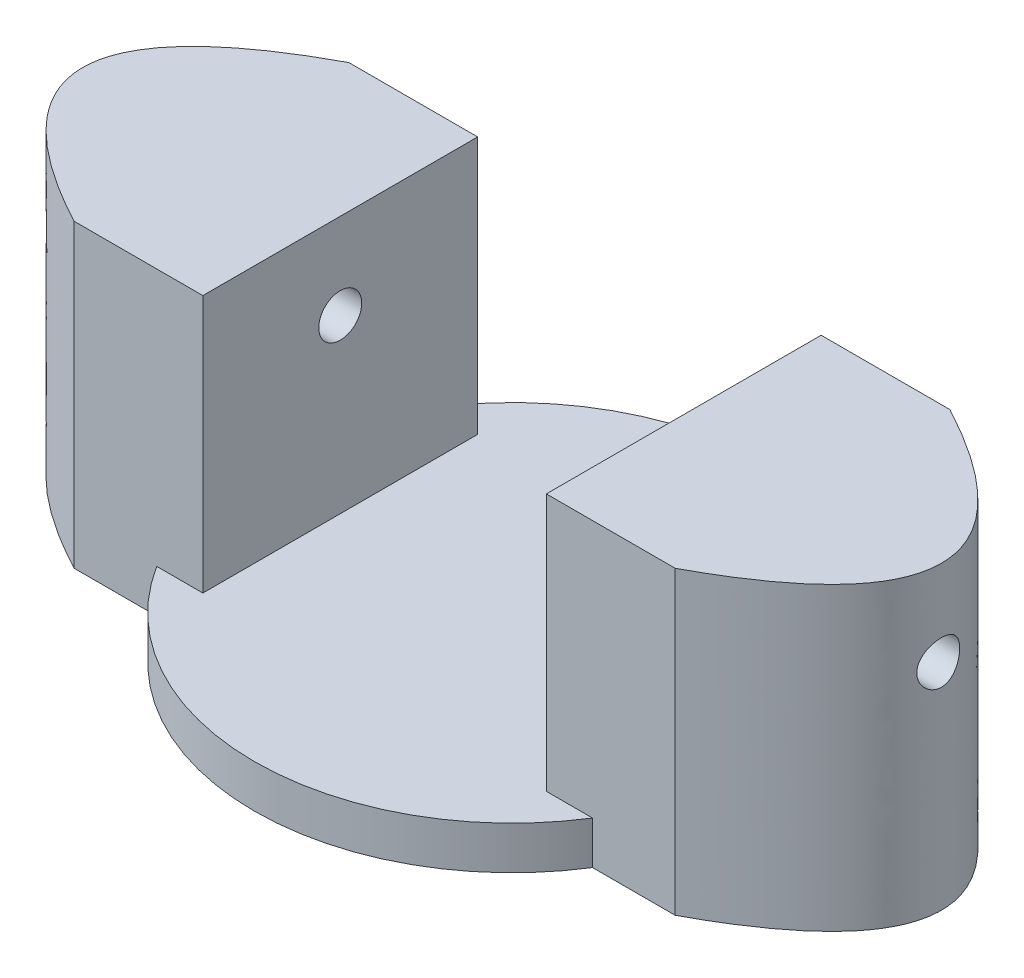
from build123d import *

# Parameters (mm, degrees)
SKETCH1_R                       = 25
BOSS_EXTRUDE1_DEPTH             = 25
SKETCH2_R                       = 150
BOSS_EXTRUDE2_DEPTH             = 25
SKETCH3_W                       = 150
SKETCH3_H                       = 160
BOSS_EXTRUDE3_DEPTH             = 150
BOSS_EXTRUDE3_DIRECTION_2_REACH = 219.945
CUT_EXTRUDE2_DEPTH              = 420.076365356
CUT_EXTRUDE2_DEPTH_BACK         = 420.076365356
SKETCH6_R                       = 12.5
CUT_EXTRUDE3_DEPTH              = 354.553390593
BOSS_EXTRUDE5_DEPTH             = 10
BOSS_EXTRUDE5_DEPTH_BACK        = 10
SKETCH9_R                       = 5


with BuildPart() as part:
    # Sketch1 → Boss-Extrude1 (new body)
    with BuildSketch(Plane(origin=(0, 0, 0), x_dir=(1, 0, 0), z_dir=(0, 1, 0))):
        with Locations(Location((0, 0, 0), (0, 0, 270))):
            Circle(SKETCH1_R)
    extrude(amount=-BOSS_EXTRUDE1_DEPTH)

    # Sketch2 → Boss-Extrude2 (add)
    with BuildSketch(Plane(origin=(0, 0, 0), x_dir=(1, 0, 0), z_dir=(0, 1, 0))):
        with Locations(Location((0, 0, 0), (0, 0, 270))):
            Circle(SKETCH2_R)
    extrude(amount=BOSS_EXTRUDE2_DEPTH)

    # Sketch3 → Boss-Extrude3 (add)
    with BuildSketch(Plane(origin=(0, 25, 0), x_dir=(1, 0, 0), z_dir=(0, 1, 0))):
        with Locations((175, 0)):
            Rectangle(SKETCH3_W, SKETCH3_H)
        with Locations((-175, 0)):
            Rectangle(SKETCH3_W, SKETCH3_H)
    extrude(amount=BOSS_EXTRUDE3_DEPTH)

    # Boss-Extrude3 direction 2: up to this face of the body (flat: up to its plane)
    boss_extrude3_direction_2_end = Plane(part.part.faces().sort_by_distance((0, 0, -145.757359313))[0])
    # Sketch3 → Boss-Extrude3 direction 2 (add, up to the picked face)
    with BuildSketch(Plane(origin=(0, 25, 0), x_dir=(1, 0, 0), z_dir=(0, 1, 0)), mode=Mode.PRIVATE) as boss_extrude3_direction_2_sk1:
        with Locations((175, 0)):
            Rectangle(SKETCH3_W, SKETCH3_H)
    boss_extrude3_direction_2_tool1 = split(extrude(boss_extrude3_direction_2_sk1.sketch, amount=-BOSS_EXTRUDE3_DIRECTION_2_REACH, mode=Mode.PRIVATE), bisect_by=boss_extrude3_direction_2_end, keep=Keep.BOTH, mode=Mode.PRIVATE)
    # Sketch3 → Boss-Extrude3 direction 2 (add, up to the picked face)
    with BuildSketch(Plane(origin=(0, 25, 0), x_dir=(1, 0, 0), z_dir=(0, 1, 0)), mode=Mode.PRIVATE) as boss_extrude3_direction_2_sk2:
        with Locations((-175, 0)):
            Rectangle(SKETCH3_W, SKETCH3_H)
    boss_extrude3_direction_2_tool2 = split(extrude(boss_extrude3_direction_2_sk2.sketch, amount=-BOSS_EXTRUDE3_DIRECTION_2_REACH, mode=Mode.PRIVATE), bisect_by=boss_extrude3_direction_2_end, keep=Keep.BOTH, mode=Mode.PRIVATE)
    add(boss_extrude3_direction_2_tool1.solids().sort_by(Axis((175, 25, 0), (0, -1, 0)))[0])
    add(boss_extrude3_direction_2_tool2.solids().sort_by(Axis((-175, 25, 0), (0, -1, 0)))[0])

    # Sketch6 → Cut-Extrude2 (cut, two sides: drawn at the far end of the back side and taken through both)
    with BuildSketch(Plane(origin=(-100, 0, 0), x_dir=(0, 0, -1), z_dir=(1, 0, 0)).offset(-CUT_EXTRUDE2_DEPTH_BACK)):
        with Locations((0, 125)):
            Circle(SKETCH6_R)
    extrude(amount=CUT_EXTRUDE2_DEPTH + CUT_EXTRUDE2_DEPTH_BACK, mode=Mode.SUBTRACT)

    # Sketch7 → Cut-Extrude3 (cut, through all)
    with BuildSketch(Plane(origin=(0, 175, 0), x_dir=(1, 0, 0), z_dir=(0, 1, 0))):
        with BuildLine():
            Line((-250, -80), (-175, -80))
            add(Edge.make_bspline(
                [(-250, 0), (-250, -40), (-175, -80)],
                knots=[0.5, 0.5, 0.5, 1, 1, 1], degree=2))
            Line((-250, 0), (-250, -80))
        make_face()
        with BuildLine():
            Line((-250, 80), (-250, 0))
            add(Edge.make_bspline(
                [(-175, 80), (-250, 40), (-250, 0)],
                knots=[0, 0, 0, 0.5, 0.5, 0.5], degree=2))
            Line((-175, 80), (-250, 80))
        make_face()
        with BuildLine():
            Line((250, -80), (250, -1.99e-07))
            add(Edge.make_bspline(
                [(250, -1.99e-07), (249.999999813, -40.0000001), (175, -80)],
                knots=[0.500000001, 0.500000001, 0.500000001, 1, 1, 1], degree=2))
            Line((175, -80), (250, -80))
        make_face()
        with BuildLine():
            Line((250, 80), (175, 80))
            add(Edge.make_bspline(
                [(175, 80), (250.000000187, 39.9999999), (250, -1.99e-07)],
                knots=[0, 0, 0, 0.500000001, 0.500000001, 0.500000001], degree=2))
            Line((250, -1.99e-07), (250, 80))
        make_face()
    extrude(amount=-CUT_EXTRUDE3_DEPTH, mode=Mode.SUBTRACT)


with BuildPart() as body_2:
    # Sketch9 → Boss-Extrude5 (new, two sides: drawn at the far end of the back side and taken through both)
    with BuildSketch(Plane(origin=(0, 0, -150), x_dir=(-1, 0, 0), z_dir=(0, 0, -1)).offset(-BOSS_EXTRUDE5_DEPTH_BACK)):
        with Locations((0, 30)):
            Circle(SKETCH9_R)
    extrude(amount=BOSS_EXTRUDE5_DEPTH + BOSS_EXTRUDE5_DEPTH_BACK)


solid = Compound([part.part, body_2.part])
